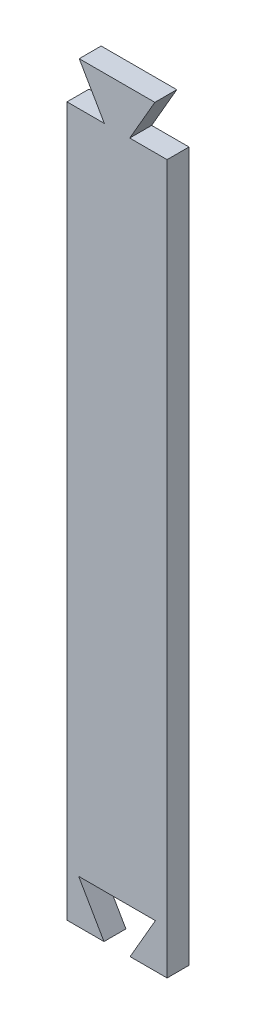
from build123d import *

# Parameters (mm, degrees)
BOSS_EXTRUDE1_DEPTH = 5.08


with BuildPart() as part:
    # Sketch1 → Boss-Extrude1 (new body)
    with BuildSketch(Plane.XY):
        Polygon((-3.024121265, 0), (-8.89, 10.16), (8.89, 10.16), (3.024121265, 0), (11.5976146, 0), (11.5976146, 164.2364), (2.941115356, 164.2364), (8.763, 174.3202), (-8.763, 174.3202), (-2.941115356, 164.2364), (-11.5976146, 164.2364), (-11.5976146, 0), align=None)
    extrude(amount=BOSS_EXTRUDE1_DEPTH)


solid = part.part
